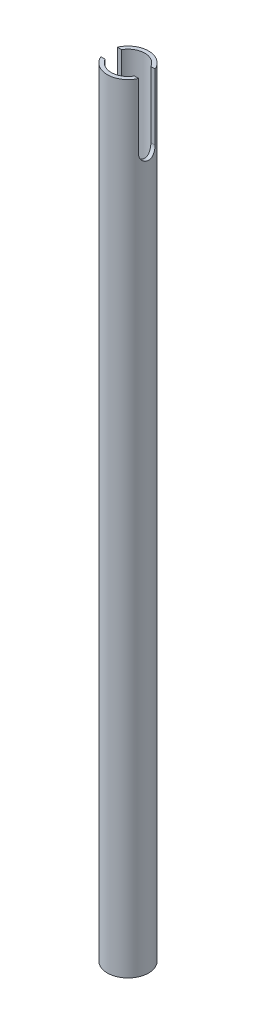
from build123d import *

# Parameters (mm, degrees)
SKETCH1_R               = 7.9375
SKETCH1_R_2             = 6.4643
BOSS_EXTRUDE1_DEPTH     = 299.825008041
CUT_EXTRUDE1_DEPTH      = 9.525
CUT_EXTRUDE1_DEPTH_BACK = 9.525


with BuildPart() as part:
    # Sketch1 → Boss-Extrude1 (new body)
    with BuildSketch(Plane(origin=(0, 0, 0), x_dir=(1, 0, 0), z_dir=(0, 1, 0))):
        with Locations(Location((0, 0, 0), (0, 0, 156.421821522))):
            Circle(SKETCH1_R)
        with Locations(Location((0, 0, 0), (0, 0, 150.583203301))):
            Circle(SKETCH1_R_2, mode=Mode.SUBTRACT)
    extrude(amount=BOSS_EXTRUDE1_DEPTH)

    # Sketch2 → Cut-Extrude1 (cut, two sides: drawn at the far end of the back side and taken through both)
    with BuildSketch(Plane(origin=(0, 0, 0), x_dir=(0, 0, -1), z_dir=(1, 0, 0)).offset(-CUT_EXTRUDE1_DEPTH_BACK)):
        with BuildLine():
            Line((3.175, 299.825008041), (3.175, 274.425008041))
            ThreePointArc((3.175, 274.425008041), (0, 271.250008041), (-3.175, 274.425008041))
            Line((-3.175, 274.425008041), (-3.175, 299.825008041))
            Line((-3.175, 299.825008041), (3.175, 299.825008041))
        make_face()
    extrude(amount=CUT_EXTRUDE1_DEPTH + CUT_EXTRUDE1_DEPTH_BACK, mode=Mode.SUBTRACT)


solid = part.part
